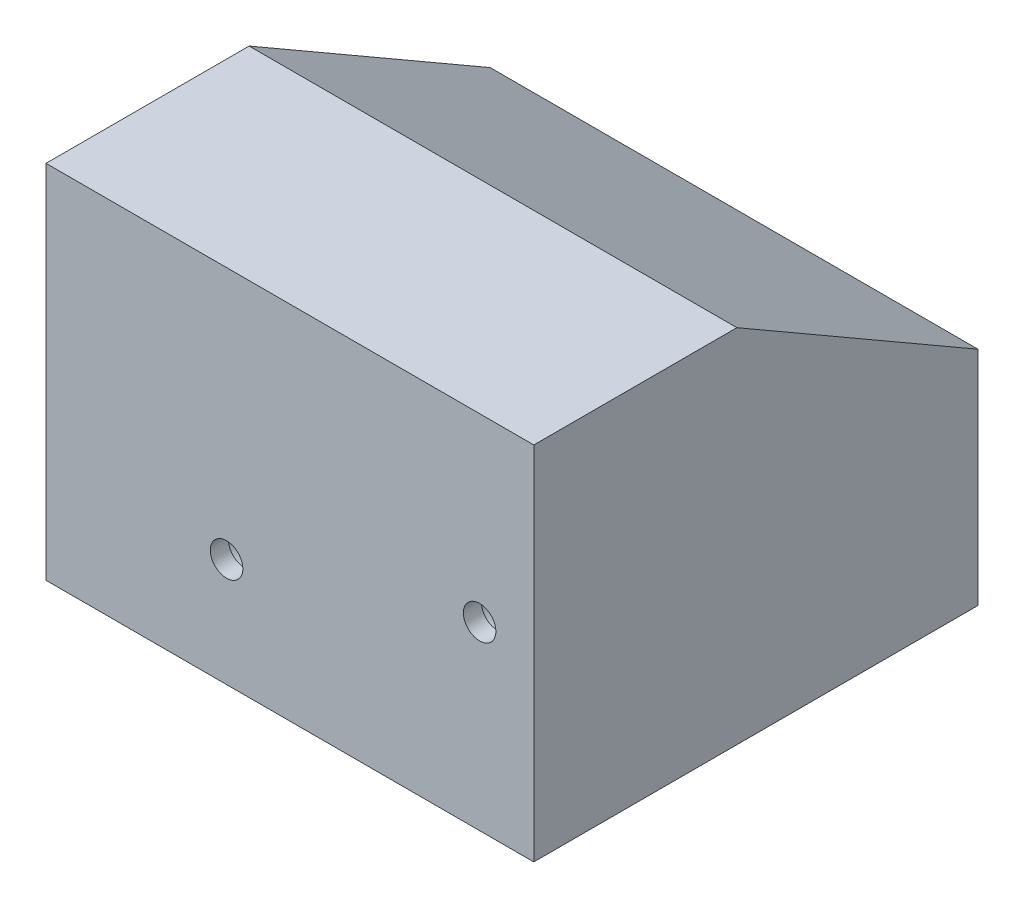
from build123d import *

# Parameters (mm, degrees)
SKIZZE1_W                                           = 135.069444444
SKIZZE1_H                                           = 100
AUFSATZ_LINEAR_AUSTRAGEN1_DEPTH                     = 123
SCHNITT_LINEAR_AUSTRAGEN1_DEPTH                     = 190.401042295
STIRNSENKUNG_F_R_M8_SENKSCHRAUBE_KOPF_B_D           = 9
STIRNSENKUNG_F_R_M8_SENKSCHRAUBE_KOPF_B_CBORE_D     = 15
STIRNSENKUNG_F_R_M8_SENKSCHRAUBE_KOPF_B_CBORE_DEPTH = 118


with BuildPart() as part:
    # Skizze1 → Aufsatz-Linear austragen1 (new body)
    with BuildSketch(Plane.XY):
        Rectangle(SKIZZE1_W, SKIZZE1_H)
    extrude(amount=AUFSATZ_LINEAR_AUSTRAGEN1_DEPTH)

    # Skizze2 → Schnitt-Linear austragen1 (cut, through all)
    with BuildSketch(Plane.ZY.offset(67.534722222)):
        Polygon((0, 11.458333333), (66.756124875, 50), (0, 71.7778768), align=None)
    extrude(amount=-SCHNITT_LINEAR_AUSTRAGEN1_DEPTH, mode=Mode.SUBTRACT)

    # Stirnsenkung für M8 Senkschraube (Kopf Button)1 (through all)
    with Locations(Plane(origin=(0, 0, 0), x_dir=(-1, 0, 0), z_dir=(0, 0, -1))):
        with Locations((-52.534722222, 0), (17.534722222, -20)):
            CounterBoreHole(STIRNSENKUNG_F_R_M8_SENKSCHRAUBE_KOPF_B_D / 2, STIRNSENKUNG_F_R_M8_SENKSCHRAUBE_KOPF_B_CBORE_D / 2, STIRNSENKUNG_F_R_M8_SENKSCHRAUBE_KOPF_B_CBORE_DEPTH)


solid = part.part
